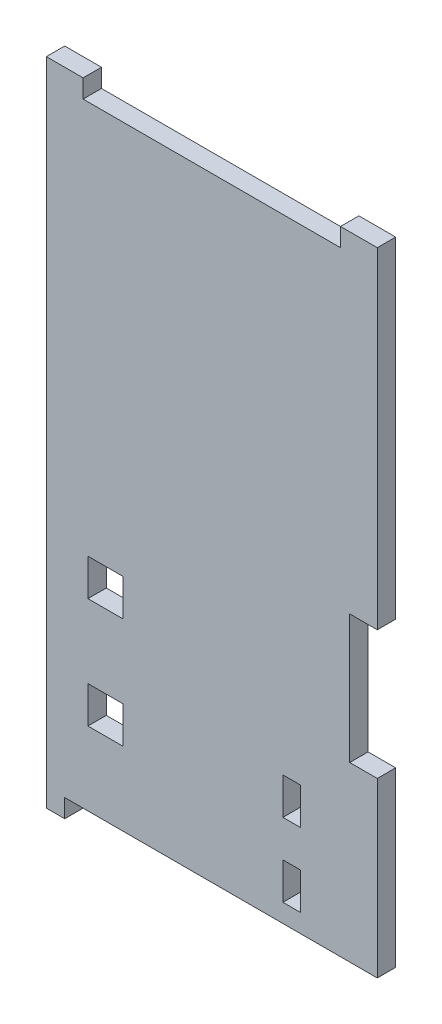
from build123d import *

# Parameters (mm, degrees)
ESQUISSE1_W        = 4.807532778
ESQUISSE1_H        = 10
ESQUISSE1_W_2      = 9.57980661
BOSS_EXTRU_1_DEPTH = 5


with BuildPart() as part:
    # Esquisse1 → Boss.-Extru.1 (new body)
    with BuildSketch(Plane.XY):
        Polygon((90, 82), (90, 167), (90, 172), (80, 172), (80, 167), (10, 167), (10, 172), (0, 172), (0, 167), (0, 0), (0, -5), (5, -5), (5, 0), (90, 0), (90, 47), (82.5, 47), (82.5, 82), align=None)
        with Locations((66.738521132, 30)):
            Rectangle(ESQUISSE1_W, ESQUISSE1_H, mode=Mode.SUBTRACT)
        with Locations((66.738521132, 10)):
            Rectangle(ESQUISSE1_W, ESQUISSE1_H, mode=Mode.SUBTRACT)
        with Locations((16.093272864, 25)):
            Rectangle(ESQUISSE1_W_2, ESQUISSE1_H, mode=Mode.SUBTRACT)
        with Locations((16.093272864, 55)):
            Rectangle(ESQUISSE1_W_2, ESQUISSE1_H, mode=Mode.SUBTRACT)
    extrude(amount=BOSS_EXTRU_1_DEPTH)


solid = part.part
